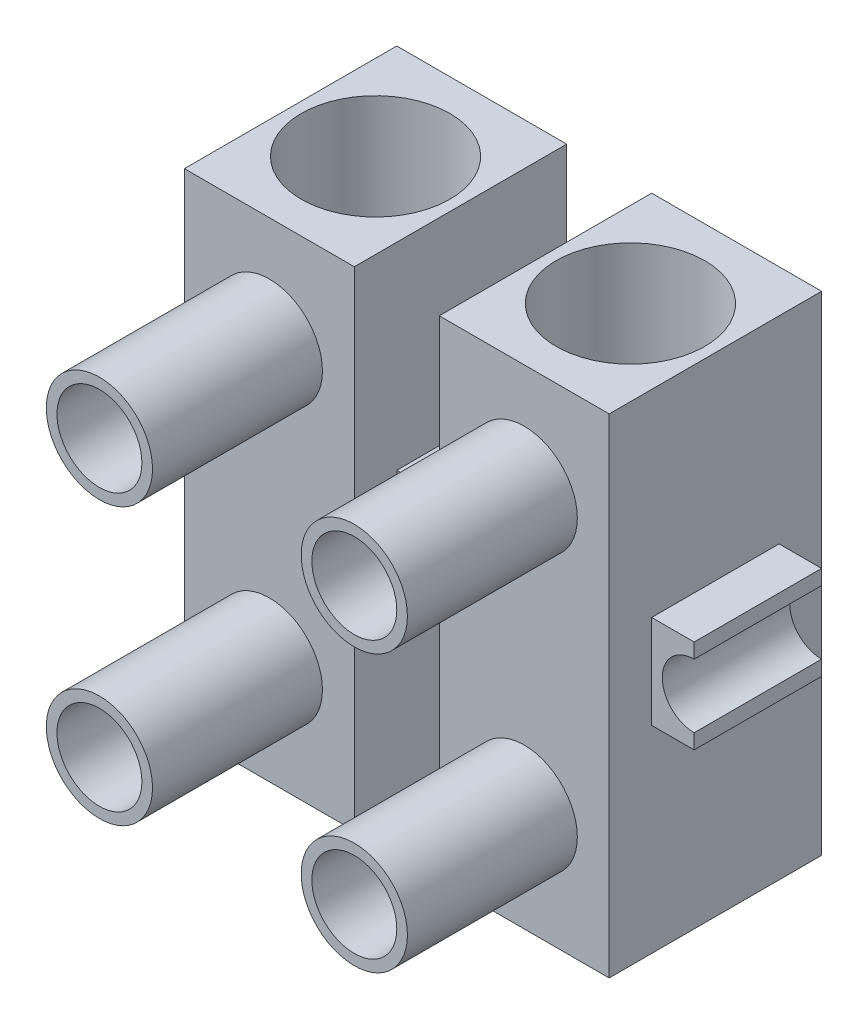
from build123d import *

# Parameters (mm, degrees)
CROQUIS1_W              = 8
CROQUIS1_H              = 23
SALIENTE_EXTRUIR1_DEPTH = 10
SALIENTE_EXTRUIR2_START = 2
SALIENTE_EXTRUIR2_DEPTH = 6
CROQUIS2_R              = 3.5
CORTAR_EXTRUIR1_DEPTH   = 26.787593916
CROQUIS3_R              = 2
CORTAR_EXTRUIR2_DEPTH   = 5
SALIENTE_EXTRUIR3_START = 8
CROQUIS3_3_R            = 2.5
CROQUIS3_3_R_2          = 2
SALIENTE_EXTRUIR3_DEPTH = 8
MATRIZL3_COUNT          = 2
MATRIZL3_PITCH          = 12


with BuildPart() as part:
    # Croquis1 → Saliente-Extruir1 (new body)
    with BuildSketch(Plane.XY):
        with Locations((0, 11.5)):
            Rectangle(CROQUIS1_W, CROQUIS1_H)
    extrude(amount=SALIENTE_EXTRUIR1_DEPTH)

    # Croquis1<3> → Saliente-Extruir2 (add)
    with BuildSketch(Plane.XY.offset(SALIENTE_EXTRUIR2_START)):
        with BuildLine():
            Line((-4, 9.3), (-4, 13.7))
            Line((-4, 13.7), (-6, 13.7))
            Line((-6, 13.7), (-6, 13))
            ThreePointArc((-6, 13), (-4.5, 11.5), (-6, 10))
            Line((-6, 10), (-6, 9.3))
            Line((-6, 9.3), (-4, 9.3))
        make_face()
        with BuildLine():
            Line((6, 13.7), (4, 13.7))
            Line((4, 13.7), (4, 9.3))
            Line((4, 9.3), (6, 9.3))
            Line((6, 9.3), (6, 10))
            ThreePointArc((6, 10), (4.5, 11.5), (6, 13))
            Line((6, 13), (6, 13.7))
        make_face()
    extrude(amount=SALIENTE_EXTRUIR2_DEPTH)

    # Croquis2 → Cortar-Extruir1 (cut, through all)
    with BuildSketch(Plane.XZ):
        with Locations((0, 5)):
            Circle(CROQUIS2_R)
    extrude(amount=-CORTAR_EXTRUIR1_DEPTH, mode=Mode.SUBTRACT)

    # Croquis3 → Cortar-Extruir2 (cut)
    with BuildSketch(Plane.XY.offset(10)):
        with Locations((0, 18)):
            Circle(CROQUIS3_R)
        with Locations((0, 5)):
            Circle(CROQUIS3_R)
    extrude(amount=-CORTAR_EXTRUIR2_DEPTH, mode=Mode.SUBTRACT)

    # Croquis3<3> → Saliente-Extruir3 (add)
    # profile 1 of 2: a face of its own
    with BuildSketch(Plane.XY.offset(10).offset(SALIENTE_EXTRUIR3_START)):
        with Locations((0, 5)):
            Circle(CROQUIS3_3_R)
        with Locations((0, 5)):
            Circle(CROQUIS3_3_R_2, mode=Mode.SUBTRACT)
    # profile 2 of 2: a face of its own
    with BuildSketch(Plane.XY.offset(10).offset(SALIENTE_EXTRUIR3_START)):
        with Locations((0, 18)):
            Circle(CROQUIS3_3_R)
        with Locations((0, 18)):
            Circle(CROQUIS3_3_R_2, mode=Mode.SUBTRACT)
    extrude(amount=-SALIENTE_EXTRUIR3_DEPTH)


with BuildPart() as matrizl3_1:
    # MatrizL3: pattern copy
    add(part.part.moved(Location(Vector(-1, 0, 0) * (1 * MATRIZL3_PITCH))))


solid = Compound([part.part, matrizl3_1.part])
